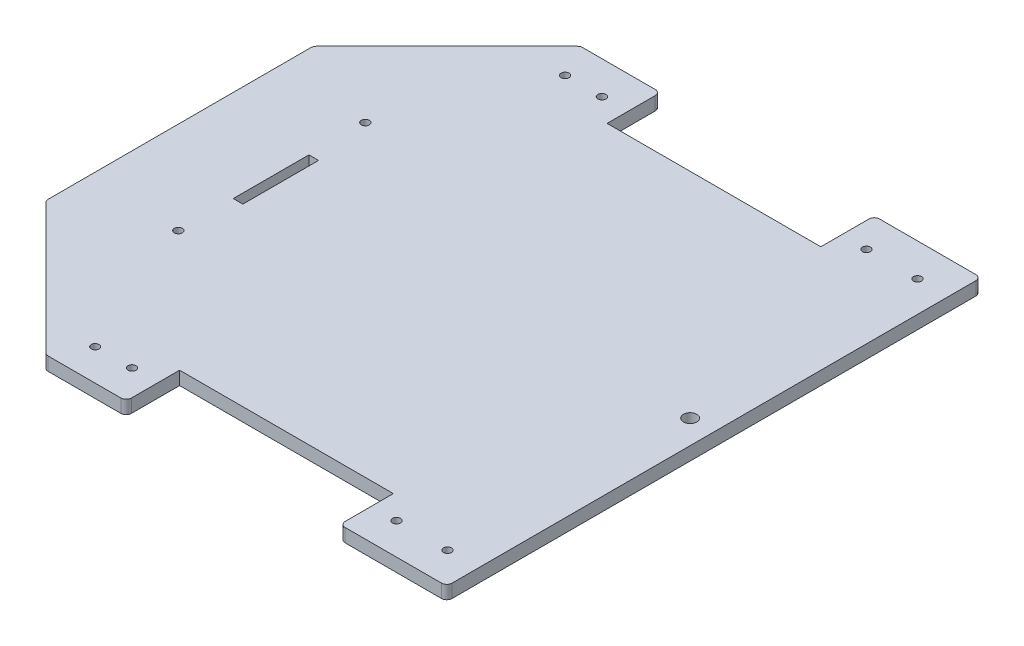
from build123d import *

# Parameters (mm, degrees)
BOSS_EXTRUDE1_DEPTH = 5
SKETCH5_R           = 2.5
CUT_EXTRUDE3_DEPTH  = 10
FILLET2_R           = 2
SKETCH6_R           = 1.5
CUT_EXTRUDE5_DEPTH  = 10
SKETCH7_W           = 3.604584819
SKETCH7_H           = 28.321717567
CUT_EXTRUDE6_DEPTH  = 10
SKETCH8_R           = 1.5
SKETCH8_R_2         = 1.459602963
CUT_EXTRUDE7_DEPTH  = 10


with BuildPart() as part:
    # Sketch1 → Boss-Extrude1 (new body)
    with BuildSketch(Plane(origin=(0, 0, 0), x_dir=(1, 0, 0), z_dir=(0, 1, 0))):
        Polygon((-12.452830189, 99.902137597), (37.547169811, 149.902137597), (67.547169811, 149.902137597), (67.547169811, 129.902137597), (147.547169811, 129.902137597), (147.547169811, 149.902137597), (187.547169811, 149.902137597), (187.547169811, -50.097862403), (147.547169811, -50.097862403), (147.547169811, -30.097862403), (67.547169811, -30.097862403), (67.547169811, -50.097862403), (37.547169811, -50.097862403), (-12.452830189, -0.097862403), align=None)
    extrude(amount=BOSS_EXTRUDE1_DEPTH)

    # Sketch5 → Cut-Extrude3 (cut)
    with BuildSketch(Plane(origin=(0, 5, 0), x_dir=(1, 0, 0), z_dir=(0, 1, 0))):
        with Locations((178.627103709, 49.902137597)):
            Circle(SKETCH5_R)
    extrude(amount=-CUT_EXTRUDE3_DEPTH, mode=Mode.SUBTRACT)

    # Fillet2
    fillet2_edges = [part.edges().sort_by_distance(p)[0] for p in [
        (147.547169811, 2.5, -149.902137597),
        (67.547169811, 2.5, -149.902137597),
        (37.547169811, 2.5, -149.902137597),
        (-12.452830189, 2.5, -99.902137597),
        (-12.452830189, 2.5, 0.097862403),
        (37.547169811, 2.5, 50.097862403),
        (67.547169811, 2.5, 50.097862403),
        (147.547169811, 2.5, 50.097862403),
        (187.547169811, 2.5, 50.097862403),
        (187.547169811, 2.5, -149.902137597),
    ]]
    fillet(fillet2_edges, radius=FILLET2_R)

    # Sketch6 → Cut-Extrude5 (cut)
    with BuildSketch(Plane(origin=(0, 5, 0), x_dir=(1, 0, 0), z_dir=(0, 1, 0))):
        with Locations((22.062785461, 14.910780602)):
            Circle(SKETCH6_R)
        with Locations((22.062785461, 84.910780602)):
            Circle(SKETCH6_R)
    extrude(amount=-CUT_EXTRUDE5_DEPTH, mode=Mode.SUBTRACT)

    # Sketch7 → Cut-Extrude6 (cut)
    with BuildSketch(Plane.XZ):
        with Locations((23.760493051, -49.732417236)):
            Rectangle(SKETCH7_W, SKETCH7_H)
    extrude(amount=-CUT_EXTRUDE6_DEPTH, mode=Mode.SUBTRACT)

    # Sketch8 → Cut-Extrude7 (cut)
    with BuildSketch(Plane(origin=(0, 5, 0), x_dir=(1, 0, 0), z_dir=(0, 1, 0))):
        with Locations((44.14258974, 137.585115599)):
            Circle(SKETCH8_R)
        with Locations((57.926617395, 137.585115599)):
            Circle(SKETCH8_R)
        with Locations((44.14258974, -38.284805306)):
            Circle(SKETCH8_R_2)
        with Locations((57.926617395, -38.284805306)):
            Circle(SKETCH8_R)
        with Locations((156.920997826, -38.284805306)):
            Circle(SKETCH8_R)
        with Locations((176.030672529, -38.284805306)):
            Circle(SKETCH8_R)
        with Locations((156.920997826, 137.585115599)):
            Circle(SKETCH8_R)
        with Locations((176.030672529, 137.585115599)):
            Circle(SKETCH8_R)
    extrude(amount=-CUT_EXTRUDE7_DEPTH, mode=Mode.SUBTRACT)


solid = part.part
